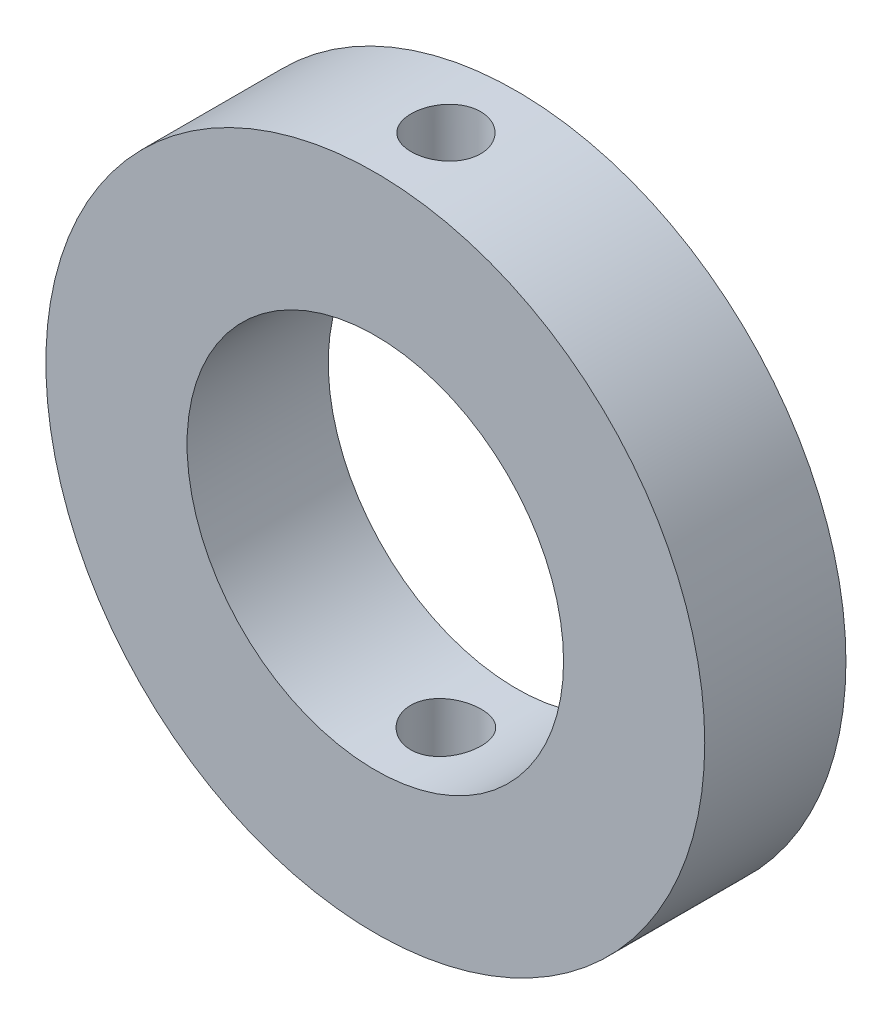
from build123d import *

# Parameters (mm, degrees)
SKETCH1_R           = 11.1125
BOSS_EXTRUDE1_DEPTH = 4.7625
SKETCH2_R           = 6.35
CUT_EXTRUDE1_DEPTH  = 17.421227687


with BuildPart() as part:
    # Sketch1 → Boss-Extrude1 (new body)
    with BuildSketch(Plane.XY):
        with Locations(Location((0, 0, 0), (0, 0, 180))):
            Circle(SKETCH1_R)
    extrude(amount=BOSS_EXTRUDE1_DEPTH)

    # Sketch2 → Cut-Extrude1 (cut, through all)
    with BuildSketch(Plane.XY.offset(4.7625)):
        Circle(SKETCH2_R)
    extrude(amount=-CUT_EXTRUDE1_DEPTH, mode=Mode.SUBTRACT)

    # Sketch3 → Cut-Revolve1 (revolve, cut)
    with BuildSketch(Plane.XY.offset(2.38125), mode=Mode.PRIVATE) as cut_revolve1_sk:
        Polygon((1.193659919, -11.1125), (1.171897939, 11.1125), (0, 11.1125), (0, -11.1125), align=None)
    revolve(cut_revolve1_sk.sketch.rotate(Axis((0, 11.1125, 2.38125), (0, -1, 0)), 224.092612296), axis=Axis((0, 11.1125, 2.38125), (0, -1, 0)), mode=Mode.SUBTRACT)


solid = part.part
